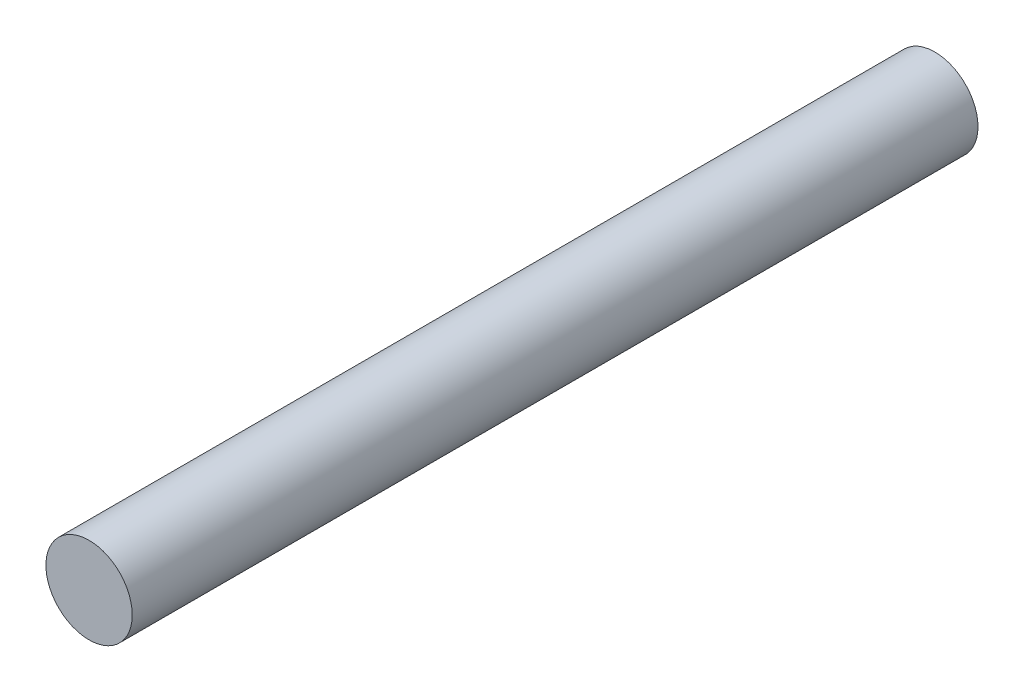
from build123d import *

# Parameters (mm, degrees)
SKETCH1_R           = 2.5
BOSS_EXTRUDE1_DEPTH = 49


with BuildPart() as part:
    # Sketch1 → Boss-Extrude1 (new body)
    with BuildSketch(Plane.XY):
        Circle(SKETCH1_R)
    extrude(amount=BOSS_EXTRUDE1_DEPTH)


solid = part.part
